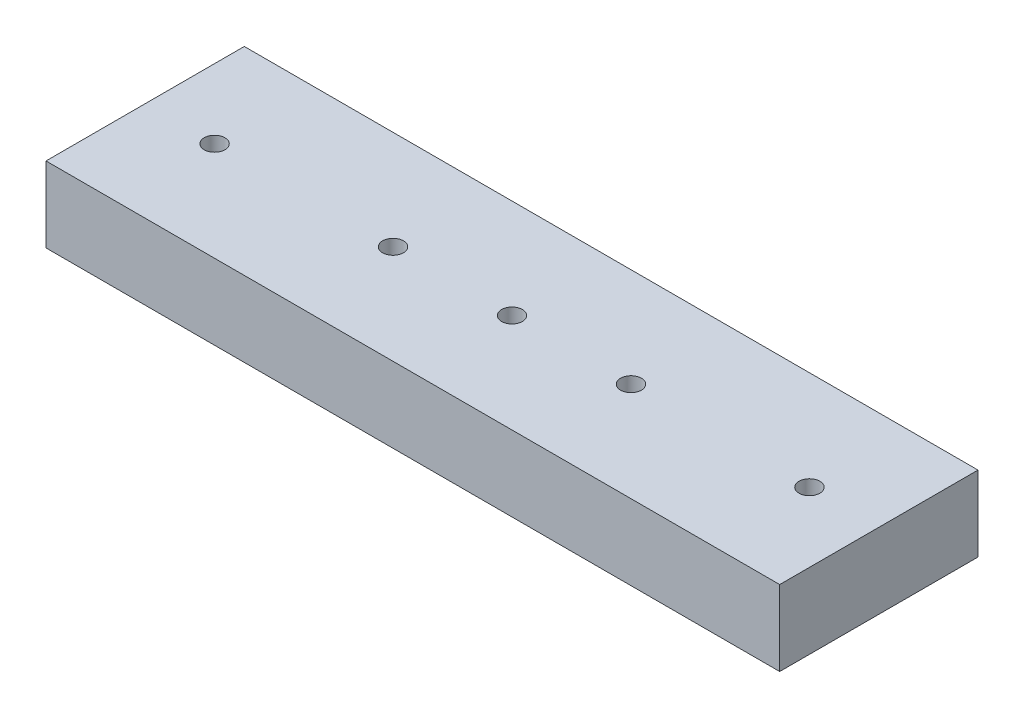
from build123d import *

# Parameters (mm, degrees)
SKETCH_1_W             = 370
SKETCH_1_H             = 100
EXTRUDE_1_DEPTH        = 38
M12X1_25_1_D           = 10.5
PATTERN_LINEAR_1_COUNT = 2
PATTERN_LINEAR_1_PITCH = 90
PATTERN_LINEAR_3_COUNT = 2
PATTERN_LINEAR_3_PITCH = 150
PATTERN_LINEAR_4_COUNT = 2
PATTERN_LINEAR_4_PITCH = 210
PATTERN_LINEAR_5_COUNT = 2
PATTERN_LINEAR_5_PITCH = 300


with BuildPart() as part:
    # 草图1 → 凸台-拉伸1 (new body)
    with BuildSketch(Plane(origin=(0, 0, 0), x_dir=(1, 0, 0), z_dir=(0, 1, 0))):
        Rectangle(SKETCH_1_W, SKETCH_1_H)
    extrude(amount=EXTRUDE_1_DEPTH)

    # M12x1.25 螺纹孔1 (through all)
    with Locations(Plane(origin=(0, 38, 0), x_dir=(1, 0, 0), z_dir=(0, 1, 0))):
        with Locations((-150, 0)):
            m12x1_25_1 = Hole(M12X1_25_1_D / 2)

    # 阵列(线性)1: M12x1.25 螺纹孔1 ×2
    with Locations(*[(i * PATTERN_LINEAR_1_PITCH, 0, 0) for i in range(1, PATTERN_LINEAR_1_COUNT)]):
        add(m12x1_25_1, mode=Mode.SUBTRACT)

    # 阵列(线性)3: M12x1.25 螺纹孔1 ×2
    with Locations(*[(i * PATTERN_LINEAR_3_PITCH, 0, 0) for i in range(1, PATTERN_LINEAR_3_COUNT)]):
        add(m12x1_25_1, mode=Mode.SUBTRACT)

    # 阵列(线性)4: M12x1.25 螺纹孔1 ×2
    with Locations(*[(i * PATTERN_LINEAR_4_PITCH, 0, 0) for i in range(1, PATTERN_LINEAR_4_COUNT)]):
        add(m12x1_25_1, mode=Mode.SUBTRACT)

    # 阵列(线性)5: M12x1.25 螺纹孔1 ×2
    with Locations(*[(i * PATTERN_LINEAR_5_PITCH, 0, 0) for i in range(1, PATTERN_LINEAR_5_COUNT)]):
        add(m12x1_25_1, mode=Mode.SUBTRACT)


solid = part.part
